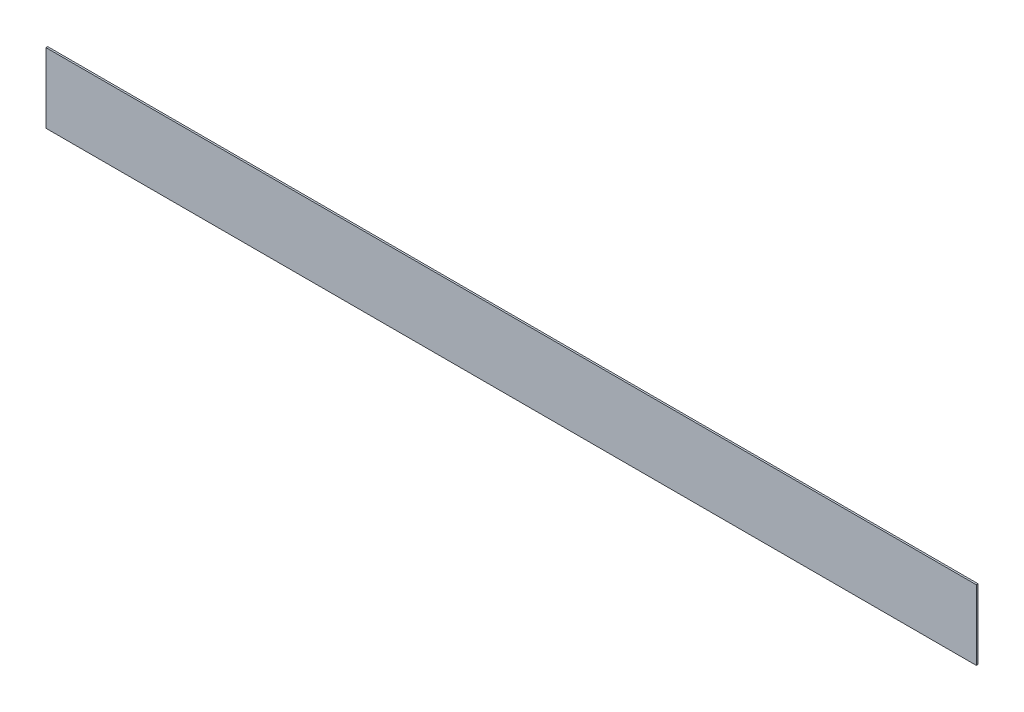
from build123d import *

# Parameters (mm, degrees)
SKETCH1_W           = 1065
SKETCH1_H           = 80
BOSS_EXTRUDE1_DEPTH = 2


with BuildPart() as part:
    # Sketch1 → Boss-Extrude1 (new body)
    with BuildSketch(Plane.XY):
        with Locations((532.5, -40)):
            Rectangle(SKETCH1_W, SKETCH1_H)
    extrude(amount=BOSS_EXTRUDE1_DEPTH)


solid = part.part
